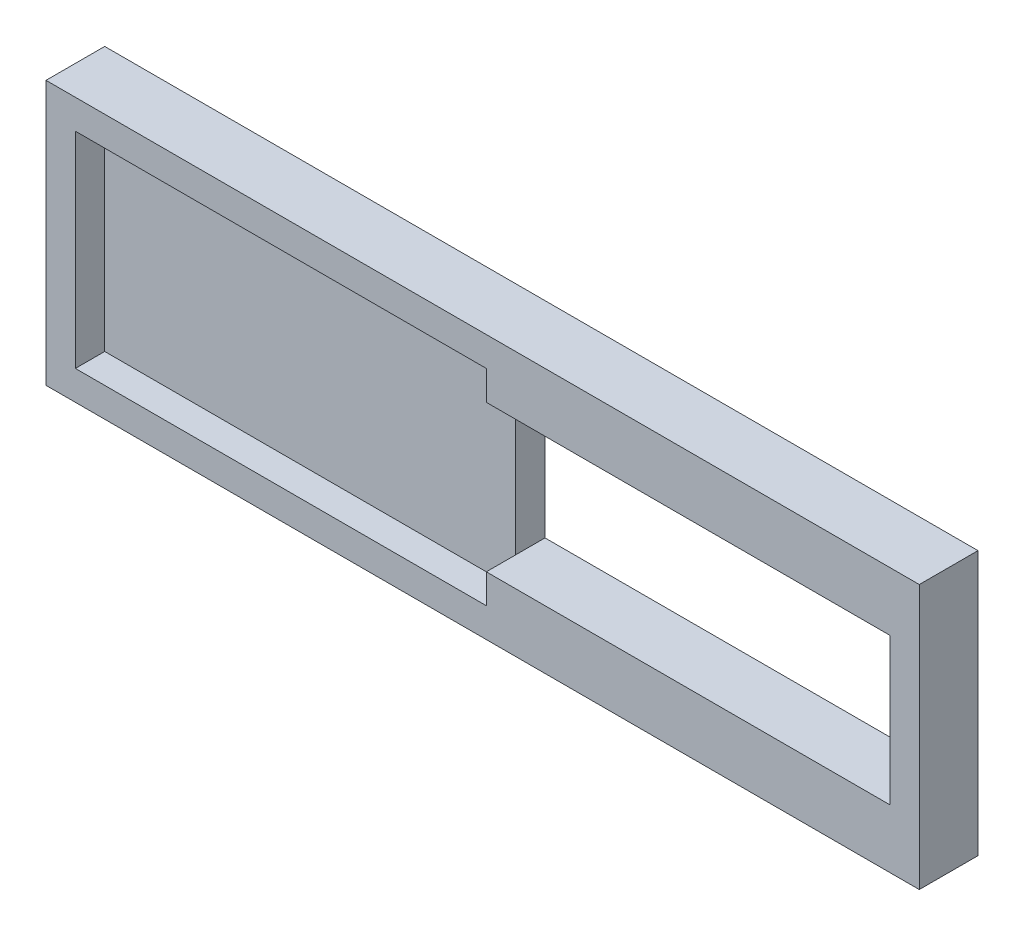
from build123d import *

# Parameters (mm, degrees)
SKETCH1_W           = 75.565
SKETCH1_H           = 22.86
BOSS_EXTRUDE1_DEPTH = 5.08
SKETCH2_W           = 35.56
SKETCH2_H           = 17.78
CUT_EXTRUDE1_DEPTH  = 2.54
SKETCH3_W           = 34.925
SKETCH3_H           = 12.7
CUT_EXTRUDE2_DEPTH  = 40.799103083


with BuildPart() as part:
    # Sketch1 → Boss-Extrude1 (new body)
    with BuildSketch(Plane.XY):
        Rectangle(SKETCH1_W, SKETCH1_H)
    extrude(amount=BOSS_EXTRUDE1_DEPTH)

    # Sketch2 → Cut-Extrude1 (cut)
    with BuildSketch(Plane.XY.offset(5.08)):
        with Locations((-17.4625, 0)):
            Rectangle(SKETCH2_W, SKETCH2_H)
    extrude(amount=-CUT_EXTRUDE1_DEPTH, mode=Mode.SUBTRACT)

    # Sketch3 → Cut-Extrude2 (cut, through all)
    with BuildSketch(Plane.XY.offset(5.08)):
        with Locations((17.78, 0)):
            Rectangle(SKETCH3_W, SKETCH3_H)
    extrude(amount=-CUT_EXTRUDE2_DEPTH, mode=Mode.SUBTRACT)


solid = part.part
